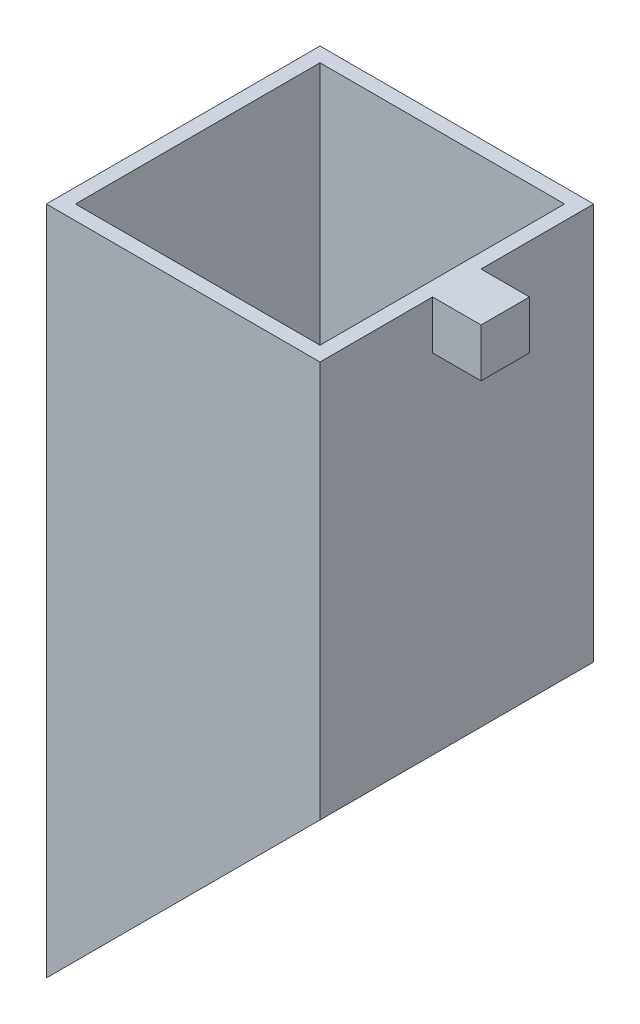
from build123d import *

# Parameters (mm, degrees)
CROQUIS1_W              = 56.5
CROQUIS1_H              = 56.5
SALIENTE_EXTRUIR1_DEPTH = 81.9
SALIENTE_EXTRUIR2_DEPTH = 56.5
VACIADO4_T              = -3
CROQUIS3_W              = 10
CROQUIS3_H              = 10
SALIENTE_EXTRUIR3_DEPTH = 10


with BuildPart() as part:
    # Croquis1 → Saliente-Extruir1 (new body)
    with BuildSketch(Plane(origin=(0, 0, 0), x_dir=(1, 0, 0), z_dir=(0, 1, 0))):
        with Locations((28.25, 28.25)):
            Rectangle(CROQUIS1_W, CROQUIS1_H)
    extrude(amount=SALIENTE_EXTRUIR1_DEPTH)

    # Croquis2 → Saliente-Extruir2 (add)
    with BuildSketch(Plane.XY):
        Polygon((0, 0), (0, -56.5), (56.5, 0), align=None)
    extrude(amount=-SALIENTE_EXTRUIR2_DEPTH)

    # Vaciado4
    vaciado4_openings = [part.faces().sort_by_distance(p)[0] for p in [
        (28.25, 81.9, -28.25),
        (28.25, -28.25, -28.25),
    ]]
    offset(amount=VACIADO4_T, openings=vaciado4_openings, kind=Kind.INTERSECTION)

    # Croquis3 → Saliente-Extruir3 (add)
    with BuildSketch(Plane(origin=(0, 81.9, 0), x_dir=(1, 0, 0), z_dir=(0, 1, 0))):
        with Locations((61.5, 28.25)):
            Rectangle(CROQUIS3_W, CROQUIS3_H)
    extrude(amount=-SALIENTE_EXTRUIR3_DEPTH)


solid = part.part
